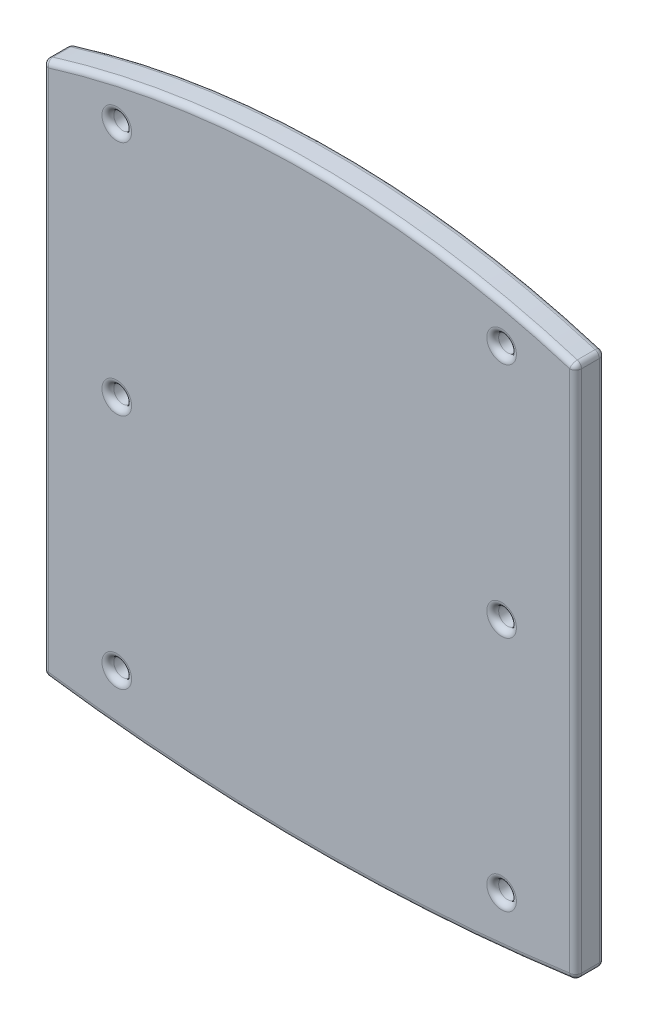
from build123d import *

# Parameters (mm, degrees)
SKETCH2_W                 = 180
SKETCH2_H                 = 180
BOSS_EXTRUDE1_DEPTH       = 10
SKETCH4_R                 = 3
CUT_EXTRUDE4_DEPTH        = 10
LPATTERN2_COUNT           = 2
LPATTERN2_PITCH           = 130
LPATTERN2_COUNT_DIR2      = 2
LPATTERN2_PITCH_DIR2      = 80
LPATTERN3_COUNT           = 2
LPATTERN3_PITCH           = 80
LPATTERN3_COPY_1_SKETCH_R = 3
LPATTERN3_COPY_1_DEPTH    = 10
LPATTERN3_COPY_2_SKETCH_R = 3
LPATTERN3_COPY_2_DEPTH    = 10
LPATTERN3_COPY_3_SKETCH_R = 3
LPATTERN3_COPY_3_DEPTH    = 10
FILLET1_R                 = 2


with BuildPart() as part:
    # Sketch2 → Boss-Extrude1 (new body)
    with BuildSketch(Plane.XY):
        with Locations((0, -3.730444936)):
            Rectangle(SKETCH2_W, SKETCH2_H)
        with BuildLine():
            ThreePointArc((-90, 86.269555064), (0, 100), (90, 86.269555064))
            Line((90, 86.269555064), (-90, 86.269555064))
        make_face()
        with BuildLine():
            ThreePointArc((90, -93.730444936), (0, -100), (-90, -93.730444936))
            Line((-90, -93.730444936), (90, -93.730444936))
        make_face()
    extrude(amount=BOSS_EXTRUDE1_DEPTH)

    # Sketch4 → Cut-Extrude4 (cut)
    with BuildSketch(Plane.XY):
        with Locations((-65, 0)):
            Circle(SKETCH4_R)
    cut_extrude4 = extrude(amount=CUT_EXTRUDE4_DEPTH, mode=Mode.SUBTRACT)

    # LPattern2: Cut-Extrude4 2 × 2
    with Locations(*[(i * LPATTERN2_PITCH, -j * LPATTERN2_PITCH_DIR2, 0) for i in range(LPATTERN2_COUNT) for j in range(LPATTERN2_COUNT_DIR2) if (i, j) != (0, 0)]):
        add(cut_extrude4, mode=Mode.SUBTRACT)

    # LPattern3: Cut-Extrude4 ×2
    with Locations(*[(0, i * LPATTERN3_PITCH, 0) for i in range(1, LPATTERN3_COUNT)]):
        add(cut_extrude4, mode=Mode.SUBTRACT)

    # LPattern3 copy 1 sketch → LPattern3 copy 1 (cut)
    with BuildSketch(Plane.XY):
        with Locations((-65, 0)):
            Circle(LPATTERN3_COPY_1_SKETCH_R)
    extrude(amount=LPATTERN3_COPY_1_DEPTH, mode=Mode.SUBTRACT)

    # LPattern3 copy 2 sketch → LPattern3 copy 2 (cut)
    with BuildSketch(Plane(origin=(130, 80, 0), x_dir=(1, 0, 0), z_dir=(0, 0, 1))):
        with Locations((-65, 0)):
            Circle(LPATTERN3_COPY_2_SKETCH_R)
    extrude(amount=LPATTERN3_COPY_2_DEPTH, mode=Mode.SUBTRACT)

    # LPattern3 copy 3 sketch → LPattern3 copy 3 (cut)
    with BuildSketch(Plane(origin=(130, 0, 0), x_dir=(1, 0, 0), z_dir=(0, 0, 1))):
        with Locations((-65, 0)):
            Circle(LPATTERN3_COPY_3_SKETCH_R)
    extrude(amount=LPATTERN3_COPY_3_DEPTH, mode=Mode.SUBTRACT)

    # Fillet1
    fillet1_edges = [part.edges().sort_by_distance(p)[0] for p in [
        (0, 100, 10),
        (-90, -3.730444936, 10),
        (-68, 0, 0),
        (-68, 0, 10),
        (0, -100, 10),
        (62, 0, 10),
        (62, 0, 0),
        (-68, -80, 10),
        (-68, -80, 0),
        (62, -80, 10),
        (62, -80, 0),
        (62, 80, 0),
        (62, 80, 10),
        (-68, 80, 0),
        (-68, 80, 10),
        (90, -3.730444936, 10),
        (0, -100, 0),
        (-90, -3.730444936, 0),
        (0, 100, 0),
        (90, -3.730444936, 0),
        (90, -93.730444936, 5),
        (-90, -93.730444936, 5),
        (-90, 86.269555064, 5),
        (90, 86.269555064, 5),
    ]]
    fillet(fillet1_edges, radius=FILLET1_R)


solid = part.part
